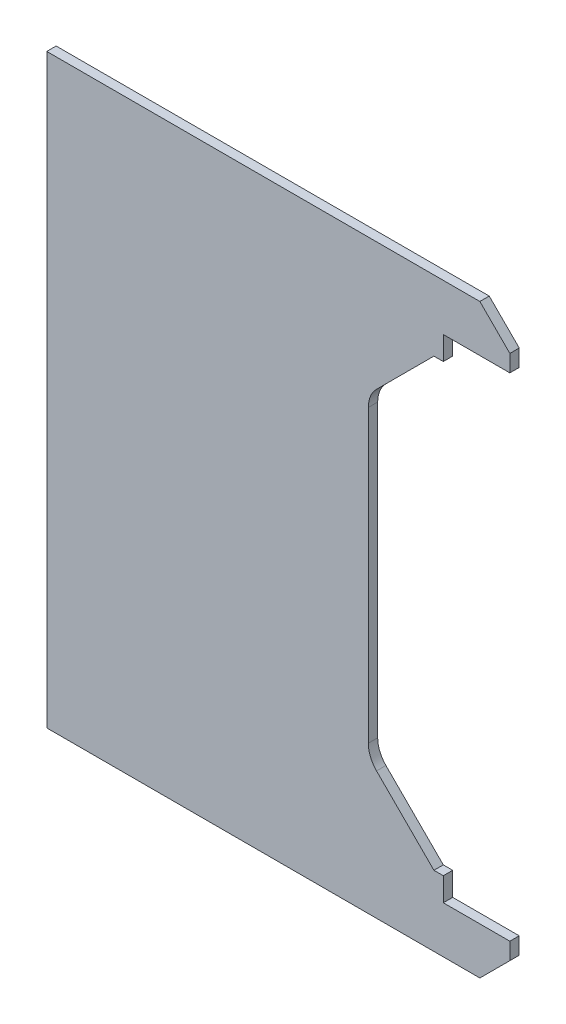
from build123d import *

# Parameters (mm, degrees)
RESSALTO_EXTRUS_O1_DEPTH = 10
CHANFRO1_SIZE            = 70
FILETE1_R                = 30


with BuildPart() as part:
    # Esboço1 → Ressalto-extrusão1 (new body)
    with BuildSketch(Plane.XY):
        Polygon((423, 50), (423, 75), (343, 75), (343, 550), (423, 550), (423, 575), (494, 575), (494, 593), (462, 625), (0, 625), (0, 0), (462, 0), (494, 32), (494, 50), align=None)
    extrude(amount=RESSALTO_EXTRUS_O1_DEPTH)

    # Chanfro1
    chanfro1_edges = [part.edges().sort_by_distance(p)[0] for p in [
        (343, 550, 5),
        (343, 75, 5),
    ]]
    chamfer(chanfro1_edges, length=CHANFRO1_SIZE)

    # Filete1
    filete1_edges = [part.edges().sort_by_distance(p)[0] for p in [
        (343, 145, 5),
        (343, 480, 5),
    ]]
    fillet(filete1_edges, radius=FILETE1_R)


solid = part.part
